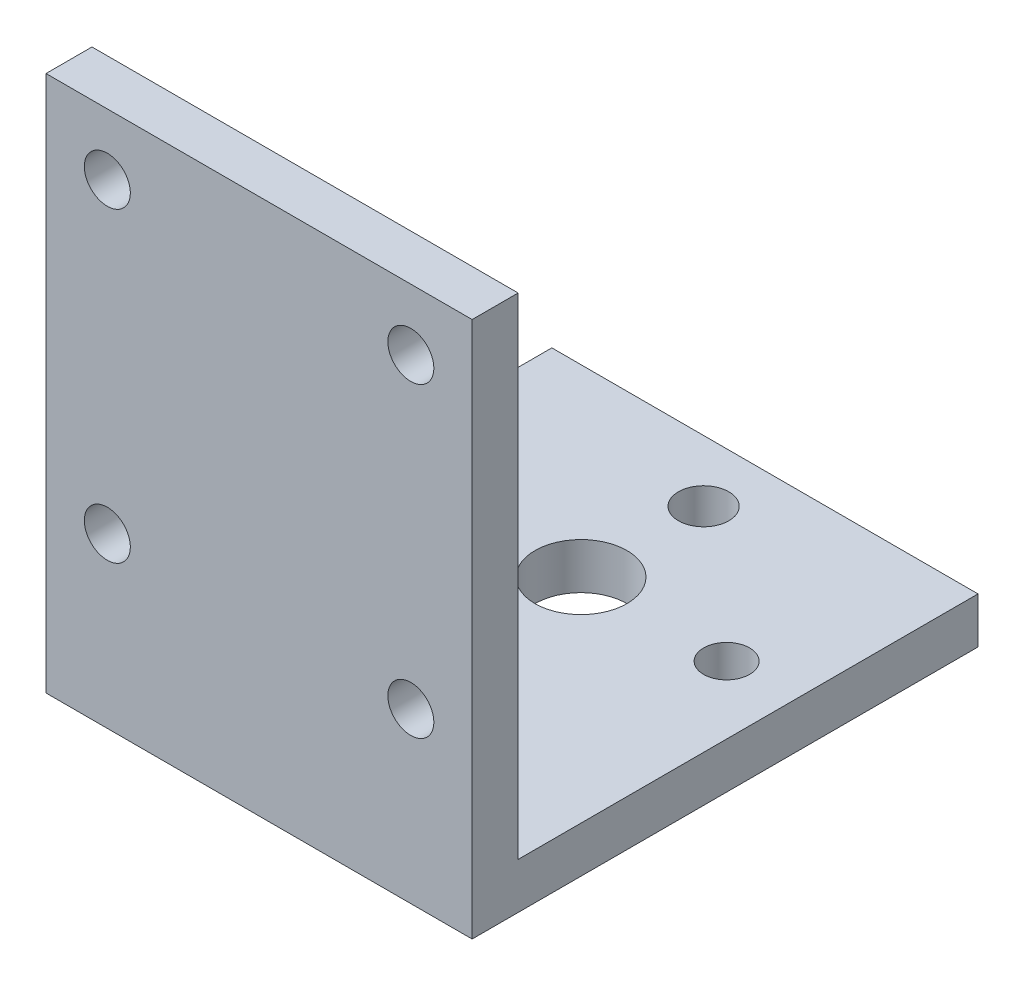
from build123d import *

# Parameters (mm, degrees)
SKETCH1_W           = 27.8
SKETCH1_H           = 33
SKETCH1_R           = 1.643134295
SKETCH1_R_2         = 3
SKETCH1_R_3         = 1.5
BOSS_EXTRUDE2_DEPTH = 3
SKETCH2_W           = 27.8
SKETCH2_H           = 3
BOSS_EXTRUDE4_DEPTH = 32
SKETCH4_R           = 1.5
CUT_EXTRUDE2_DEPTH  = 32


with BuildPart() as part:
    # Sketch1 → Boss-Extrude2 (new body)
    with BuildSketch(Plane(origin=(0, 0, 0), x_dir=(1, 0, 0), z_dir=(0, 1, 0))):
        with Locations((-63.812097694, -4.729298211)):
            Rectangle(SKETCH1_W, SKETCH1_H)
        with Locations(Location((-63.812097694, 7.770701789, 0), (0, 0, 270))):
            Circle(SKETCH1_R, mode=Mode.SUBTRACT)
        with Locations(Location((-63.812097694, -0.229298211, 0), (0, 0, 270))):
            Circle(SKETCH1_R_2, mode=Mode.SUBTRACT)
        with Locations(Location((-63.812097694, -8.229298211, 0), (0, 0, 270))):
            Circle(SKETCH1_R_3, mode=Mode.SUBTRACT)
        with Locations(Location((-73.312097694, -0.229298211, 0), (0, 0, 270))):
            Circle(SKETCH1_R_3, mode=Mode.SUBTRACT)
        with Locations(Location((-54.312097694, -0.229298211, 0), (0, 0, 270))):
            Circle(SKETCH1_R_3, mode=Mode.SUBTRACT)
    extrude(amount=BOSS_EXTRUDE2_DEPTH)

    # Sketch2 → Boss-Extrude4 (add)
    with BuildSketch(Plane(origin=(0, 3, 0), x_dir=(1, 0, 0), z_dir=(0, 1, 0))):
        with Locations((-63.812097694, -19.729298211)):
            Rectangle(SKETCH2_W, SKETCH2_H)
    extrude(amount=BOSS_EXTRUDE4_DEPTH)

    # Sketch4 → Cut-Extrude2 (cut)
    with BuildSketch(Plane(origin=(0, 0, 18.229298211), x_dir=(-1, 0, 0), z_dir=(0, 0, -1))):
        with Locations((53.912097694, 11)):
            Circle(SKETCH4_R)
        with Locations((73.712097694, 31)):
            Circle(SKETCH4_R)
        with Locations((53.912097694, 31)):
            Circle(SKETCH4_R)
        with Locations((73.712097694, 11)):
            Circle(SKETCH4_R)
    extrude(amount=-CUT_EXTRUDE2_DEPTH, mode=Mode.SUBTRACT)


solid = part.part
